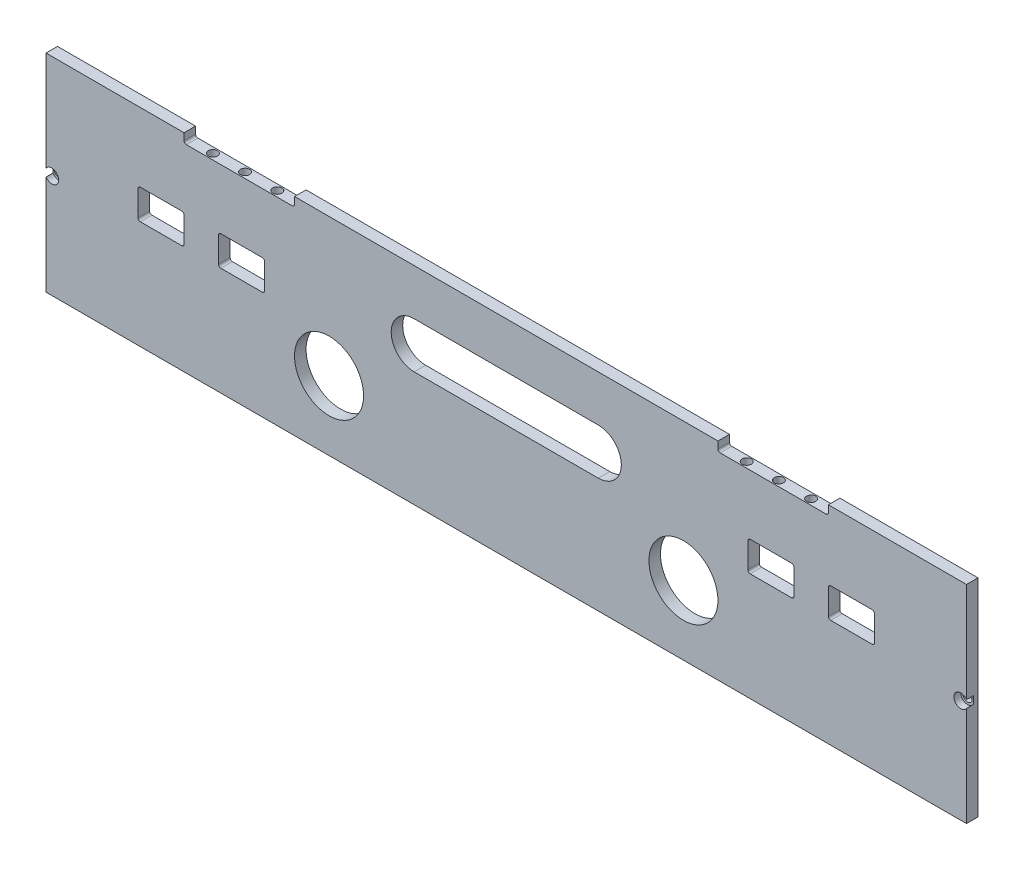
from build123d import *

# Parameters (mm, degrees)
SKETCH1_R           = 15
SKETCH1_R_2         = 2
SKETCH1_W           = 20
SKETCH1_H           = 13
BOSS_EXTRUDE1_DEPTH = 5
CUT_EXTRUDE2_START  = -3
SKETCH6_R           = 3
SKETCH6_R_2         = 2
CUT_EXTRUDE2_DEPTH  = 3
FILLET1_R           = 1
SKETCH7_R           = 1.25
CUT_EXTRUDE3_DEPTH  = 15
SKETCH9_R           = 2
CUT_EXTRUDE4_DEPTH  = 8
SKETCH8_R           = 2
CUT_EXTRUDE5_DEPTH  = 8


with BuildPart() as part:
    # Sketch1 → Boss-Extrude1 (new body)
    with BuildSketch(Plane.XY):
        Polygon((0, 90), (0, 0), (400, 0), (400, 90), (340, 90), (340, 86), (292, 86), (292, 90), (108, 90), (108, 86), (60, 86), (60, 90), align=None)
        with Locations((123, 30)):
            Circle(SKETCH1_R, mode=Mode.SUBTRACT)
        with Locations((277, 30)):
            Circle(SKETCH1_R, mode=Mode.SUBTRACT)
        with Locations((2.5, 45)):
            Circle(SKETCH1_R_2, mode=Mode.SUBTRACT)
        with Locations((50, 53.5)):
            Rectangle(SKETCH1_W, SKETCH1_H, mode=Mode.SUBTRACT)
        with Locations((85, 53.5)):
            Rectangle(SKETCH1_W, SKETCH1_H, mode=Mode.SUBTRACT)
        with BuildLine():
            ThreePointArc((160, 50), (150, 60), (160, 70))
            Line((160, 70), (240, 70))
            ThreePointArc((240, 70), (250, 60), (240, 50))
            Line((240, 50), (160, 50))
        make_face(mode=Mode.SUBTRACT)
        with Locations((315, 53.5)):
            Rectangle(SKETCH1_W, SKETCH1_H, mode=Mode.SUBTRACT)
        with Locations((397.5, 45)):
            Circle(SKETCH1_R_2, mode=Mode.SUBTRACT)
        with Locations((350, 53.5)):
            Rectangle(SKETCH1_W, SKETCH1_H, mode=Mode.SUBTRACT)
    extrude(amount=BOSS_EXTRUDE1_DEPTH)

    # Sketch6 → Cut-Extrude2 (cut)
    # profile 1 of 2: a face of its own
    with BuildSketch(Plane.XY.offset(5).offset(CUT_EXTRUDE2_START)):
        with Locations((397.5, 45)):
            Circle(SKETCH6_R)
        with Locations((397.5, 45)):
            Circle(SKETCH6_R_2, mode=Mode.SUBTRACT)
    # profile 2 of 2: a face of its own
    with BuildSketch(Plane.XY.offset(5).offset(CUT_EXTRUDE2_START)):
        with Locations((2.5, 45)):
            Circle(SKETCH6_R)
        with Locations((2.5, 45)):
            Circle(SKETCH6_R_2, mode=Mode.SUBTRACT)
    extrude(amount=CUT_EXTRUDE2_DEPTH, mode=Mode.SUBTRACT)

    # Fillet1
    fillet1_edges = [part.edges().sort_by_distance(p)[0] for p in [
        (340, 60, 2.5),
        (340, 47, 2.5),
        (360, 47, 2.5),
        (360, 60, 2.5),
        (305, 60, 2.5),
        (305, 47, 2.5),
        (325, 47, 2.5),
        (325, 60, 2.5),
        (75, 60, 2.5),
        (75, 47, 2.5),
        (95, 47, 2.5),
        (95, 60, 2.5),
        (40, 60, 2.5),
        (40, 47, 2.5),
        (60, 47, 2.5),
        (60, 60, 2.5),
        (60, 86, 2.5),
        (108, 86, 2.5),
        (292, 86, 2.5),
        (340, 86, 2.5),
    ]]
    fillet(fillet1_edges, radius=FILLET1_R)

    # Sketch7 → Cut-Extrude3 (cut)
    with BuildSketch(Plane.XZ):
        with Locations(Location((360, 2.5, 0), (0, 0, 270))):
            Circle(SKETCH7_R)
        with Locations(Location((40, 2.5, 0), (0, 0, 270))):
            Circle(SKETCH7_R)
    extrude(amount=-CUT_EXTRUDE3_DEPTH, mode=Mode.SUBTRACT)

    # Sketch9 → Cut-Extrude4 (cut)
    with BuildSketch(Plane(origin=(0, 86, 0), x_dir=(1, 0, 0), z_dir=(0, 1, 0))):
        with Locations(Location((330, -2.5, 0), (0, 0, 270))):
            Circle(SKETCH9_R)
        with Locations(Location((316, -2.5, 0), (0, 0, 270))):
            Circle(SKETCH9_R)
        with Locations(Location((302, -2.5, 0), (0, 0, 270))):
            Circle(SKETCH9_R)
    extrude(amount=-CUT_EXTRUDE4_DEPTH, mode=Mode.SUBTRACT)

    # Sketch8 → Cut-Extrude5 (cut)
    with BuildSketch(Plane(origin=(0, 86, 0), x_dir=(1, 0, 0), z_dir=(0, 1, 0))):
        with Locations(Location((70, -2.5, 0), (0, 0, 180))):
            Circle(SKETCH8_R)
        with Locations(Location((84, -2.5, 0), (0, 0, 180))):
            Circle(SKETCH8_R)
        with Locations(Location((98, -2.5, 0), (0, 0, 180))):
            Circle(SKETCH8_R)
    extrude(amount=-CUT_EXTRUDE5_DEPTH, mode=Mode.SUBTRACT)


solid = part.part
